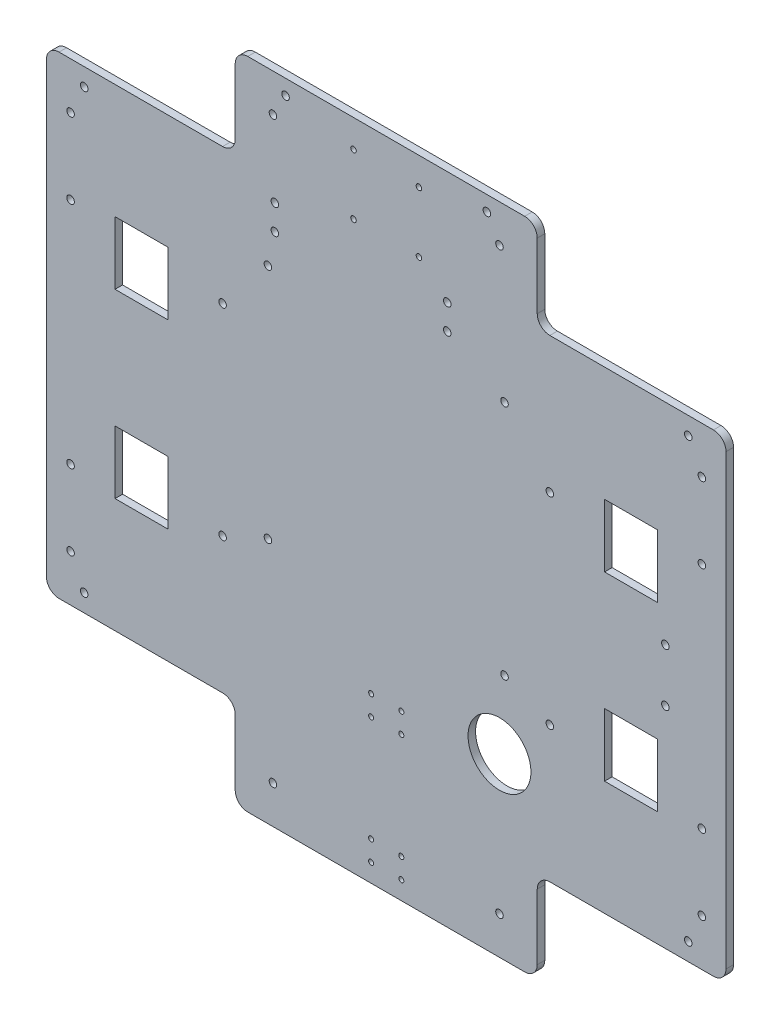
from build123d import *

# Parameters (mm, degrees)
SKETCH_1_W           = 270
SKETCH_1_H           = 260
EXTRUDE_1_DEPTH      = 3
CUT_EXTRUDE_1_REACH  = 189.441
SKETCH_2_W           = 75
SKETCH_2_H           = 36
SKETCH_2_W_2         = 21
SKETCH_2_H_2         = 25
FILLET_1_R           = 5
SKETCH_3_R           = 1.5
CUT_EXTRUDE_2_DEPTH  = 10
SKETCH_4_R           = 1.5
CUT_EXTRUDE_3_DEPTH  = 188.440657276
SKETCH_5_R           = 1.5
CUT_EXTRUDE_4_DEPTH  = 188.440657276
SKETCH_6_R           = 1
CUT_EXTRUDE_5_DEPTH  = 188.440657276
SKETCH_7_R           = 1.5
CUT_EXTRUDE_6_DEPTH  = 188.440657276
SKETCH_8_R           = 1.5
CUT_EXTRUDE_7_DEPTH  = 188.440657276
SKETCH_9_R           = 1.1
CUT_EXTRUDE_8_DEPTH  = 188.440657276
CUT_EXTRUDE_9_REACH  = 189.441
SKETCH_10_R          = 1.5
SKETCH_11_R          = 12.5
CUT_EXTRUDE_10_DEPTH = 10


with BuildPart() as part:
    # 草图1 → 凸台-拉伸1 (new body)
    with BuildSketch(Plane.XY):
        Rectangle(SKETCH_1_W, SKETCH_1_H)
    extrude(amount=EXTRUDE_1_DEPTH)

    # 草图2 → 切除-拉伸1 (cut, up to next)
    with BuildSketch(Plane(origin=(0, 0, 0), x_dir=(-1, 0, 0), z_dir=(0, 0, -1)), mode=Mode.PRIVATE) as cut_extrude_1_sk1:
        with Locations((97.5, -112)):
            Rectangle(SKETCH_2_W, SKETCH_2_H)
    cut_extrude_1_tool1 = extrude(cut_extrude_1_sk1.sketch, amount=-CUT_EXTRUDE_1_REACH, mode=Mode.PRIVATE) & part.part
    # 草图2 → 切除-拉伸1 (cut, up to next)
    with BuildSketch(Plane(origin=(0, 0, 0), x_dir=(-1, 0, 0), z_dir=(0, 0, -1)), mode=Mode.PRIVATE) as cut_extrude_1_sk2:
        with Locations((97.25, -36)):
            Rectangle(SKETCH_2_W_2, SKETCH_2_H_2)
    cut_extrude_1_tool2 = extrude(cut_extrude_1_sk2.sketch, amount=-CUT_EXTRUDE_1_REACH, mode=Mode.PRIVATE) & part.part
    # 草图2 → 切除-拉伸1 (cut, up to next)
    with BuildSketch(Plane(origin=(0, 0, 0), x_dir=(-1, 0, 0), z_dir=(0, 0, -1)), mode=Mode.PRIVATE) as cut_extrude_1_sk3:
        with Locations((-97.5, 112)):
            Rectangle(SKETCH_2_W, SKETCH_2_H)
    cut_extrude_1_tool3 = extrude(cut_extrude_1_sk3.sketch, amount=-CUT_EXTRUDE_1_REACH, mode=Mode.PRIVATE) & part.part
    # 草图2 → 切除-拉伸1 (cut, up to next)
    with BuildSketch(Plane(origin=(0, 0, 0), x_dir=(-1, 0, 0), z_dir=(0, 0, -1)), mode=Mode.PRIVATE) as cut_extrude_1_sk4:
        with Locations((-97.25, -36)):
            Rectangle(SKETCH_2_W_2, SKETCH_2_H_2)
    cut_extrude_1_tool4 = extrude(cut_extrude_1_sk4.sketch, amount=-CUT_EXTRUDE_1_REACH, mode=Mode.PRIVATE) & part.part
    # 草图2 → 切除-拉伸1 (cut, up to next)
    with BuildSketch(Plane(origin=(0, 0, 0), x_dir=(-1, 0, 0), z_dir=(0, 0, -1)), mode=Mode.PRIVATE) as cut_extrude_1_sk5:
        with Locations((-97.5, -112)):
            Rectangle(SKETCH_2_W, SKETCH_2_H)
    cut_extrude_1_tool5 = extrude(cut_extrude_1_sk5.sketch, amount=-CUT_EXTRUDE_1_REACH, mode=Mode.PRIVATE) & part.part
    # 草图2 → 切除-拉伸1 (cut, up to next)
    with BuildSketch(Plane(origin=(0, 0, 0), x_dir=(-1, 0, 0), z_dir=(0, 0, -1)), mode=Mode.PRIVATE) as cut_extrude_1_sk6:
        with Locations((-97.25, 36)):
            Rectangle(SKETCH_2_W_2, SKETCH_2_H_2)
    cut_extrude_1_tool6 = extrude(cut_extrude_1_sk6.sketch, amount=-CUT_EXTRUDE_1_REACH, mode=Mode.PRIVATE) & part.part
    # 草图2 → 切除-拉伸1 (cut, up to next)
    with BuildSketch(Plane(origin=(0, 0, 0), x_dir=(-1, 0, 0), z_dir=(0, 0, -1)), mode=Mode.PRIVATE) as cut_extrude_1_sk7:
        with Locations((97.25, 36)):
            Rectangle(SKETCH_2_W_2, SKETCH_2_H_2)
    cut_extrude_1_tool7 = extrude(cut_extrude_1_sk7.sketch, amount=-CUT_EXTRUDE_1_REACH, mode=Mode.PRIVATE) & part.part
    # 草图2 → 切除-拉伸1 (cut, up to next)
    with BuildSketch(Plane(origin=(0, 0, 0), x_dir=(-1, 0, 0), z_dir=(0, 0, -1)), mode=Mode.PRIVATE) as cut_extrude_1_sk8:
        with Locations((97.5, 112)):
            Rectangle(SKETCH_2_W, SKETCH_2_H)
    cut_extrude_1_tool8 = extrude(cut_extrude_1_sk8.sketch, amount=-CUT_EXTRUDE_1_REACH, mode=Mode.PRIVATE) & part.part
    add(cut_extrude_1_tool1.solids().sort_by_distance((-97.5, -112, 0))[0], mode=Mode.SUBTRACT)
    add(cut_extrude_1_tool2.solids().sort_by_distance((-97.25, -36, 0))[0], mode=Mode.SUBTRACT)
    add(cut_extrude_1_tool3.solids().sort_by_distance((97.5, 112, 0))[0], mode=Mode.SUBTRACT)
    add(cut_extrude_1_tool4.solids().sort_by_distance((97.25, -36, 0))[0], mode=Mode.SUBTRACT)
    add(cut_extrude_1_tool5.solids().sort_by_distance((97.5, -112, 0))[0], mode=Mode.SUBTRACT)
    add(cut_extrude_1_tool6.solids().sort_by_distance((97.25, 36, 0))[0], mode=Mode.SUBTRACT)
    add(cut_extrude_1_tool7.solids().sort_by_distance((-97.25, 36, 0))[0], mode=Mode.SUBTRACT)
    add(cut_extrude_1_tool8.solids().sort_by_distance((-97.5, 112, 0))[0], mode=Mode.SUBTRACT)

    # 圆角1
    fillet_1_edges = [part.edges().sort_by_distance(p)[0] for p in [
        (135, 94, 1.5),
        (60, 130, 1.5),
        (60, 94, 1.5),
        (60, -130, 1.5),
        (135, -94, 1.5),
        (60, -94, 1.5),
        (-60, 130, 1.5),
        (-135, 94, 1.5),
        (-60, 94, 1.5),
        (-135, -94, 1.5),
        (-60, -130, 1.5),
        (-60, -94, 1.5),
    ]]
    fillet(fillet_1_edges, radius=FILLET_1_R)

    # 草图3 → 切除-拉伸2 (cut)
    with BuildSketch(Plane.XY.offset(3)):
        with Locations((-47, -32)):
            Circle(SKETCH_3_R)
        with Locations((47, -32)):
            Circle(SKETCH_3_R)
        with Locations((47, 62)):
            Circle(SKETCH_3_R)
        with Locations((-47, 62)):
            Circle(SKETCH_3_R)
    extrude(amount=-CUT_EXTRUDE_2_DEPTH, mode=Mode.SUBTRACT)

    # 草图4 → 切除-拉伸3 (cut, through all)
    with BuildSketch(Plane.XY.offset(3)):
        with Locations((45, 115)):
            Circle(SKETCH_4_R)
        with Locations((120, 87)):
            Circle(SKETCH_4_R)
        with Locations((120, -87)):
            Circle(SKETCH_4_R)
        with Locations((45, -115)):
            Circle(SKETCH_4_R)
        with Locations(Location((-45, -115, 0), (0, 0, 180))):
            Circle(SKETCH_4_R)
        with Locations(Location((-120, -87, 0), (0, 0, 180))):
            Circle(SKETCH_4_R)
        with Locations(Location((-120, 87, 0), (0, 0, 180))):
            Circle(SKETCH_4_R)
        with Locations(Location((-45, 115, 0), (0, 0, 180))):
            Circle(SKETCH_4_R)
        with Locations((-65, 40)):
            Circle(SKETCH_4_R)
        with Locations((65, 40)):
            Circle(SKETCH_4_R)
        with Locations((-65, -40)):
            Circle(SKETCH_4_R)
        with Locations((65, -40)):
            Circle(SKETCH_4_R)
    extrude(amount=-CUT_EXTRUDE_3_DEPTH, mode=Mode.SUBTRACT)

    # 草图5 → 切除-拉伸4 (cut, through all)
    with BuildSketch(Plane.XY.offset(3)):
        with Locations((125.408441645, -45.5)):
            Circle(SKETCH_5_R)
        with Locations((125.406892783, -75.49999996)):
            Circle(SKETCH_5_R)
        with Locations(Location((125.406892783, 75.49999996, 0), (0, 0, 180))):
            Circle(SKETCH_5_R)
        with Locations(Location((125.408441645, 45.5, 0), (0, 0, 180))):
            Circle(SKETCH_5_R)
        with Locations(Location((-125.406892783, -75.49999996, 0), (0, 0, 180))):
            Circle(SKETCH_5_R)
        with Locations(Location((-125.408441645, -45.5, 0), (0, 0, 180))):
            Circle(SKETCH_5_R)
        with Locations((-125.408441645, 45.5)):
            Circle(SKETCH_5_R)
        with Locations((-125.406892783, 75.49999996)):
            Circle(SKETCH_5_R)
    extrude(amount=-CUT_EXTRUDE_4_DEPTH, mode=Mode.SUBTRACT)

    # 草图6 → 切除-拉伸5 (cut, through all)
    with BuildSketch(Plane.XY.offset(3)):
        with Locations((-6, -114.75)):
            Circle(SKETCH_6_R)
        with Locations((6, -114.75)):
            Circle(SKETCH_6_R)
        with Locations((-6, -122.75)):
            Circle(SKETCH_6_R)
        with Locations((6, -122.75)):
            Circle(SKETCH_6_R)
        with Locations((-6, -72.75)):
            Circle(SKETCH_6_R)
        with Locations((6, -72.75)):
            Circle(SKETCH_6_R)
        with Locations((-6, -64.75)):
            Circle(SKETCH_6_R)
        with Locations((6, -64.75)):
            Circle(SKETCH_6_R)
    extrude(amount=-CUT_EXTRUDE_5_DEPTH, mode=Mode.SUBTRACT)

    # 草图7 → 切除-拉伸6 (cut, through all)
    with BuildSketch(Plane.XY.offset(3)):
        with Locations((110.9, 10.5)):
            Circle(SKETCH_7_R)
        with Locations((110.9, -10.5)):
            Circle(SKETCH_7_R)
    extrude(amount=-CUT_EXTRUDE_6_DEPTH, mode=Mode.SUBTRACT)

    # 草图8 → 切除-拉伸7 (cut, through all)
    with BuildSketch(Plane.XY.offset(3)):
        with Locations((-40, 124)):
            Circle(SKETCH_8_R)
        with Locations((40, 124)):
            Circle(SKETCH_8_R)
    extrude(amount=-CUT_EXTRUDE_7_DEPTH, mode=Mode.SUBTRACT)

    # 草图9 → 切除-拉伸8 (cut, through all)
    with BuildSketch(Plane.XY.offset(3)):
        with Locations((-13, 119)):
            Circle(SKETCH_9_R)
        with Locations((13, 119)):
            Circle(SKETCH_9_R)
        with Locations((-13, 95)):
            Circle(SKETCH_9_R)
        with Locations((13, 95)):
            Circle(SKETCH_9_R)
    extrude(amount=-CUT_EXTRUDE_8_DEPTH, mode=Mode.SUBTRACT)

    # 草图10 → 切除-拉伸9 (cut, up to next)
    with BuildSketch(Plane.XY.offset(3), mode=Mode.PRIVATE) as cut_extrude_9_sk1:
        with Locations((-44.249999943, 85.000444876)):
            Circle(SKETCH_10_R)
    cut_extrude_9_tool1 = extrude(cut_extrude_9_sk1.sketch, amount=-CUT_EXTRUDE_9_REACH, mode=Mode.PRIVATE) & part.part
    # 草图10 → 切除-拉伸9 (cut, up to next)
    with BuildSketch(Plane.XY.offset(3), mode=Mode.PRIVATE) as cut_extrude_9_sk2:
        with Locations((-44.249999943, 75)):
            Circle(SKETCH_10_R)
    cut_extrude_9_tool2 = extrude(cut_extrude_9_sk2.sketch, amount=-CUT_EXTRUDE_9_REACH, mode=Mode.PRIVATE) & part.part
    # 草图10 → 切除-拉伸9 (cut, up to next)
    with BuildSketch(Plane.XY.offset(3), mode=Mode.PRIVATE) as cut_extrude_9_sk3:
        with Locations((24.25, 85)):
            Circle(SKETCH_10_R)
    cut_extrude_9_tool3 = extrude(cut_extrude_9_sk3.sketch, amount=-CUT_EXTRUDE_9_REACH, mode=Mode.PRIVATE) & part.part
    # 草图10 → 切除-拉伸9 (cut, up to next)
    with BuildSketch(Plane.XY.offset(3), mode=Mode.PRIVATE) as cut_extrude_9_sk4:
        with Locations((24.25, 75)):
            Circle(SKETCH_10_R)
    cut_extrude_9_tool4 = extrude(cut_extrude_9_sk4.sketch, amount=-CUT_EXTRUDE_9_REACH, mode=Mode.PRIVATE) & part.part
    add(cut_extrude_9_tool1.solids().sort_by_distance((-44.25, 85.000445, 3))[0], mode=Mode.SUBTRACT)
    add(cut_extrude_9_tool2.solids().sort_by_distance((-44.25, 75, 3))[0], mode=Mode.SUBTRACT)
    add(cut_extrude_9_tool3.solids().sort_by_distance((24.25, 85, 3))[0], mode=Mode.SUBTRACT)
    add(cut_extrude_9_tool4.solids().sort_by_distance((24.25, 75, 3))[0], mode=Mode.SUBTRACT)

    # 草图11 → 切除-拉伸10 (cut)
    with BuildSketch(Plane.XY.offset(3)):
        with Locations((45, -60)):
            Circle(SKETCH_11_R)
    extrude(amount=-CUT_EXTRUDE_10_DEPTH, mode=Mode.SUBTRACT)


solid = part.part
